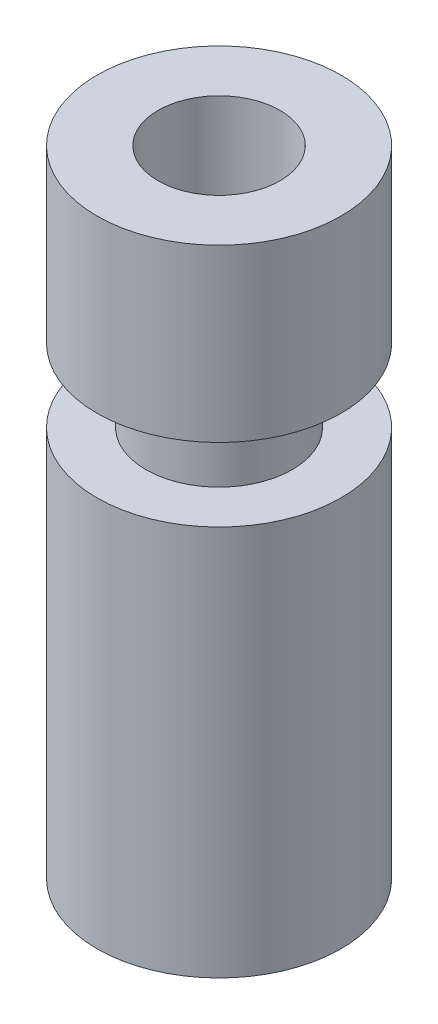
from build123d import *

# Parameters (mm, degrees)
SKETCH1_R           = 2.5
BOSS_EXTRUDE1_DEPTH = 8
SKETCH2_R           = 1.5
BOSS_EXTRUDE2_DEPTH = 1.5
SKETCH3_R           = 2.5
BOSS_EXTRUDE3_DEPTH = 3.5
SKETCH4_R           = 1.25
CUT_EXTRUDE1_DEPTH  = 2


with BuildPart() as part:
    # Sketch1 → Boss-Extrude1 (new body)
    with BuildSketch(Plane(origin=(0, 0, 0), x_dir=(1, 0, 0), z_dir=(0, 1, 0))):
        with Locations(Location((0, 0, 0), (0, 0, 270))):
            Circle(SKETCH1_R)
    extrude(amount=BOSS_EXTRUDE1_DEPTH)

    # Sketch2 → Boss-Extrude2 (add)
    with BuildSketch(Plane(origin=(0, 8, 0), x_dir=(1, 0, 0), z_dir=(0, 1, 0))):
        with Locations(Location((0, 0, 0), (0, 0, 270))):
            Circle(SKETCH2_R)
    extrude(amount=BOSS_EXTRUDE2_DEPTH)

    # Sketch3 → Boss-Extrude3 (add)
    with BuildSketch(Plane(origin=(0, 9.5, 0), x_dir=(1, 0, 0), z_dir=(0, 1, 0))):
        with Locations(Location((0, 0, 0), (0, 0, 270))):
            Circle(SKETCH3_R)
    extrude(amount=BOSS_EXTRUDE3_DEPTH)

    # Sketch4 → Cut-Extrude1 (cut)
    with BuildSketch(Plane(origin=(0, 13, 0), x_dir=(1, 0, 0), z_dir=(0, 1, 0))):
        with Locations(Location((0, 0, 0), (0, 0, 270))):
            Circle(SKETCH4_R)
    extrude(amount=-CUT_EXTRUDE1_DEPTH, mode=Mode.SUBTRACT)


solid = part.part
